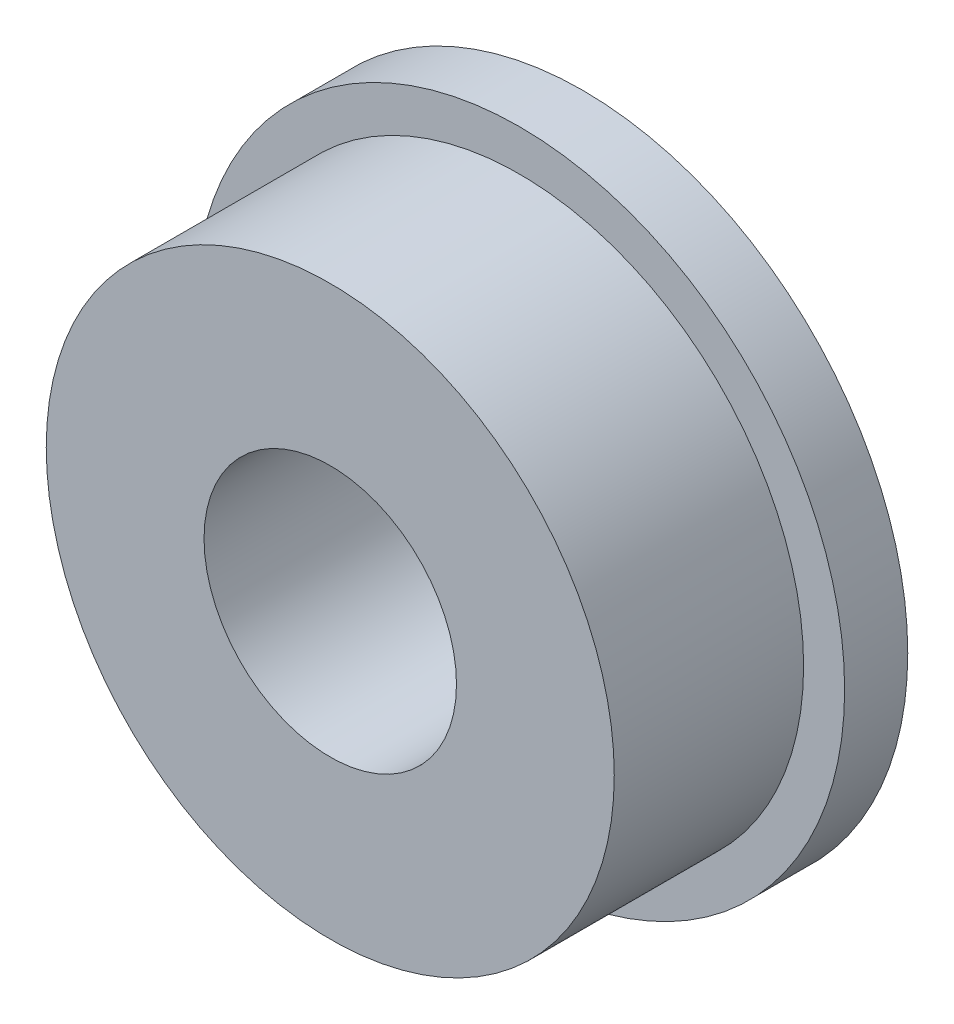
from build123d import *

# Parameters (mm, degrees)
SKETCH1_R           = 4.5
SKETCH1_R_2         = 2
BOSS_EXTRUDE1_DEPTH = 4
SKETCH2_R           = 5.15
SKETCH2_R_2         = 2
BOSS_EXTRUDE2_DEPTH = 1


with BuildPart() as part:
    # Sketch1 → Boss-Extrude1 (new body)
    with BuildSketch(Plane.XY):
        Circle(SKETCH1_R)
        Circle(SKETCH1_R_2, mode=Mode.SUBTRACT)
    extrude(amount=BOSS_EXTRUDE1_DEPTH)

    # Sketch2 → Boss-Extrude2 (add)
    with BuildSketch(Plane(origin=(0, 0, 0), x_dir=(-1, 0, 0), z_dir=(0, 0, -1))):
        Circle(SKETCH2_R)
        with Locations(Location((0, 0, 0), (0, 0, 180))):
            Circle(SKETCH2_R_2, mode=Mode.SUBTRACT)
    extrude(amount=-BOSS_EXTRUDE2_DEPTH)


solid = part.part
